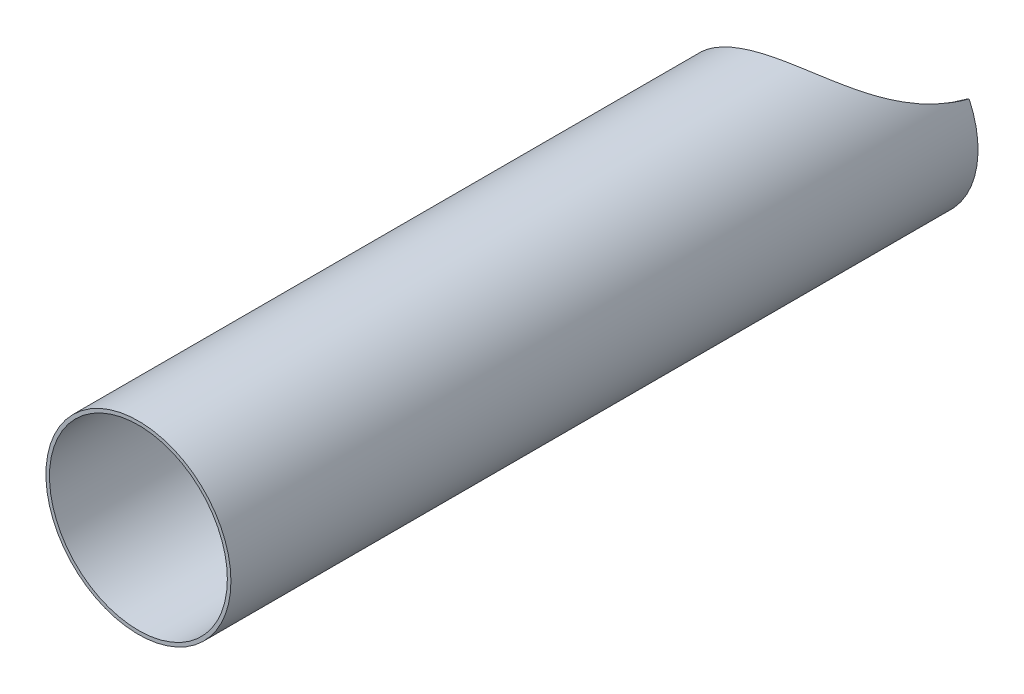
from build123d import *

# Parameters (mm, degrees)
ESQUISSE1_R             = 26
ESQUISSE1_R_2           = 25
BOSS_EXTRU_1_DEPTH      = 210
ESQUISSE5_R             = 47.695529837
ENL_V_MAT_EXTRU_1_DEPTH = 60


with BuildPart() as part:
    # Esquisse1 → Boss.-Extru.1 (new body)
    with BuildSketch(Plane.XY):
        Circle(ESQUISSE1_R)
        Circle(ESQUISSE1_R_2, mode=Mode.SUBTRACT)
    extrude(amount=BOSS_EXTRU_1_DEPTH)

    # Esquisse5 → Enlèv. mat.-Extru.1 (cut)
    with BuildSketch(Plane(origin=(23.624930764, 14.073260048, 0), x_dir=(0, 0, 1), z_dir=(-0.8591201996284968, -0.5117738588383465, 0))):
        with Locations((-10, 44.176041201)):
            Circle(ESQUISSE5_R)
    extrude(amount=ENL_V_MAT_EXTRU_1_DEPTH, mode=Mode.SUBTRACT)


solid = part.part
